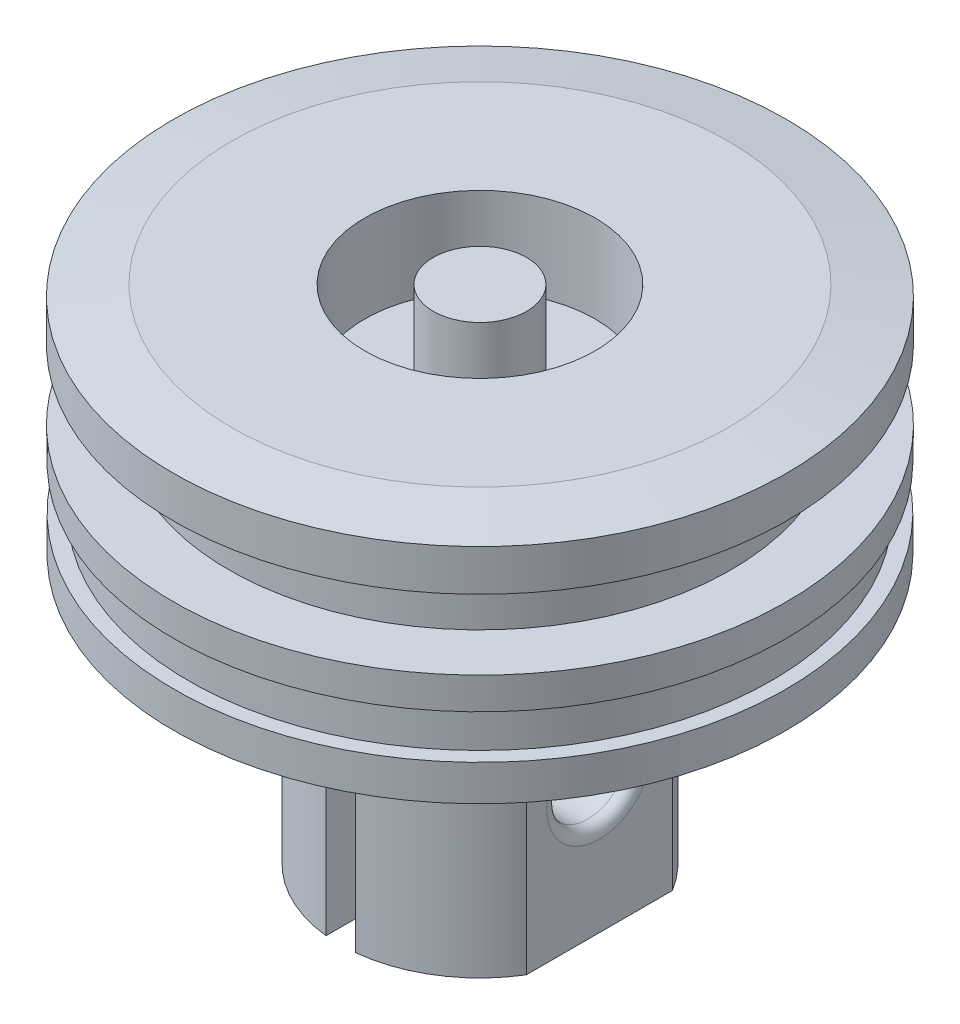
from build123d import *

# Parameters (mm, degrees)
CHAMFER1_SIZE      = 2.54
CHAMFER1_SIZE2     = 0.447870531
SKETCH3_W          = 1.27
SKETCH3_H          = 11.684
SKETCH3_W_2        = 0.896537977
SKETCH3_H_2        = 11.167643875
CUT_EXTRUDE2_DEPTH = 25.4
SKETCH4_R          = 1.783288569
CUT_EXTRUDE3_DEPTH = 32.616251091
FILLET1_R          = 0.508
SKETCH5_R          = 5.0165
SKETCH5_R_2        = 2.032
CUT_EXTRUDE4_DEPTH = 3.81


with BuildPart() as part:
    # Sketch1 → Revolve1 (revolve)
    with BuildSketch(Plane.XY, mode=Mode.PRIVATE) as revolve1_sk:
        Polygon((0, 0), (13.34752775, 0), (13.34752775, -2.248031717), (10.93452775, -2.248031717), (10.93452775, -5.296031717), (13.34752775, -5.296031717), (13.328344425, -6.6929), (12.693344425, -6.6929), (12.693344425, -8.5979), (13.328344425, -8.5979), (13.328344425, -10.16), (6.096, -10.16), (6.096, -21.844), (0, -21.844), (0, -10.16), align=None)
    revolve(revolve1_sk.sketch.rotate(Axis((0, 0, 0), (0, 1, 0)), 90), axis=Axis((0, 0, 0), (0, 1, 0)))

    # Chamfer1
    chamfer1_edges = [part.edges().sort_by_distance(p)[0] for p in [
        (0, 0, 13.34752775),
    ]]
    chamfer1_side = [part.faces().sort_by_distance(p)[0] for p in [
        (0, 0, 0),
    ]]
    chamfer(chamfer1_edges, length=CHAMFER1_SIZE, length2=CHAMFER1_SIZE2, reference=chamfer1_side[0])

    # Sketch3 → Cut-Extrude2 (cut)
    with BuildSketch(Plane.XY.offset(13.335)):
        with Locations((0, -16.002)):
            Rectangle(SKETCH3_W, SKETCH3_H)
        with Locations((5.647731012, -16.260178062)):
            Rectangle(SKETCH3_W_2, SKETCH3_H_2)
        with Locations((-5.647731012, -16.260178062)):
            Rectangle(SKETCH3_W_2, SKETCH3_H_2)
    extrude(amount=-CUT_EXTRUDE2_DEPTH, mode=Mode.SUBTRACT)

    # Sketch4 → Cut-Extrude3 (cut, through all)
    with BuildSketch(Plane(origin=(5.207, 0, 0), x_dir=(0, 0, -1), z_dir=(1, 0, 0))):
        with Locations((0, -16.034094945)):
            Circle(SKETCH4_R)
    extrude(amount=-CUT_EXTRUDE3_DEPTH, mode=Mode.SUBTRACT)

    # Fillet1
    fillet1_edges = [part.edges().sort_by_distance(p)[0] for p in [
        (5.199462023, -16.034094945, 1.783288569),
    ]]
    fillet(fillet1_edges, radius=FILLET1_R)

    # Sketch5 → Cut-Extrude4 (cut)
    with BuildSketch(Plane(origin=(0, 0, 0), x_dir=(1, 0, 0), z_dir=(0, 1, 0))):
        with Locations(Location((0, 0, 0), (0, 0, 270))):
            Circle(SKETCH5_R)
        with Locations(Location((0, 0, 0), (0, 0, 270))):
            Circle(SKETCH5_R_2, mode=Mode.SUBTRACT)
    extrude(amount=-CUT_EXTRUDE4_DEPTH, mode=Mode.SUBTRACT)


solid = part.part
